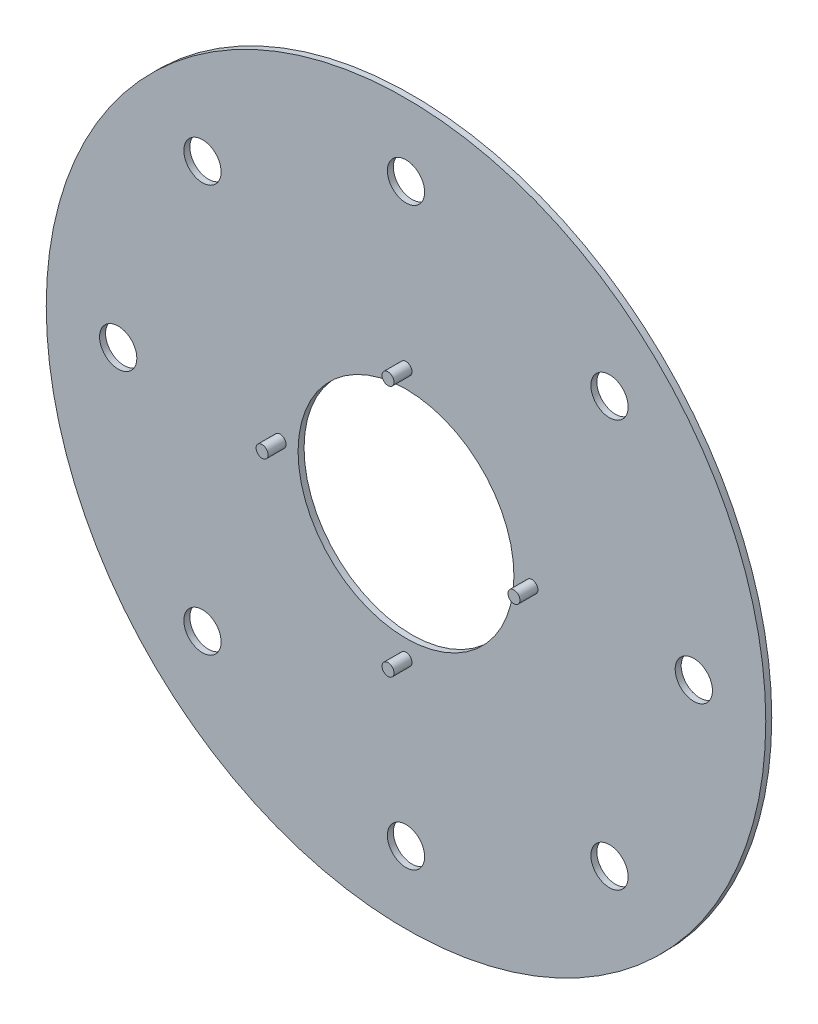
from build123d import *

# Parameters (mm, degrees)
SKETCH1_R           = 60
SKETCH1_R_2         = 12.7
SKETCH1_R_3         = 3.107194875
BOSS_EXTRUDE4_DEPTH = 1
SKETCH4_R           = 1
BOSS_EXTRUDE5_DEPTH = 3
SKETCH5_R           = 18
CUT_EXTRUDE1_DEPTH  = 3


with BuildPart() as part:
    # Sketch1 → Boss-Extrude4 (new body)
    with BuildSketch(Plane.XY):
        Circle(SKETCH1_R)
        Circle(SKETCH1_R_2, mode=Mode.SUBTRACT)
        with Locations((0, 48)):
            Circle(SKETCH1_R_3, mode=Mode.SUBTRACT)
        with Locations((33.941125497, 33.941125497)):
            Circle(SKETCH1_R_3, mode=Mode.SUBTRACT)
        with Locations((48, 0)):
            Circle(SKETCH1_R_3, mode=Mode.SUBTRACT)
        with Locations((33.941125497, -33.941125497)):
            Circle(SKETCH1_R_3, mode=Mode.SUBTRACT)
        with Locations((0, -48)):
            Circle(SKETCH1_R_3, mode=Mode.SUBTRACT)
        with Locations((-33.941125497, -33.941125497)):
            Circle(SKETCH1_R_3, mode=Mode.SUBTRACT)
        with Locations((-48, 0)):
            Circle(SKETCH1_R_3, mode=Mode.SUBTRACT)
        with Locations((-33.941125497, 33.941125497)):
            Circle(SKETCH1_R_3, mode=Mode.SUBTRACT)
    extrude(amount=BOSS_EXTRUDE4_DEPTH)

    # Sketch4 → Boss-Extrude5 (add)
    with BuildSketch(Plane.XY.offset(1)):
        with Locations((0, 21)):
            Circle(SKETCH4_R)
        with Locations((21, 0)):
            Circle(SKETCH4_R)
        with Locations((0, -21)):
            Circle(SKETCH4_R)
        with Locations((-21, 0)):
            Circle(SKETCH4_R)
    extrude(amount=BOSS_EXTRUDE5_DEPTH)

    # Sketch5 → Cut-Extrude1 (cut)
    with BuildSketch(Plane.XY.offset(1)):
        Circle(SKETCH5_R)
    extrude(amount=-CUT_EXTRUDE1_DEPTH, mode=Mode.SUBTRACT)


solid = part.part
